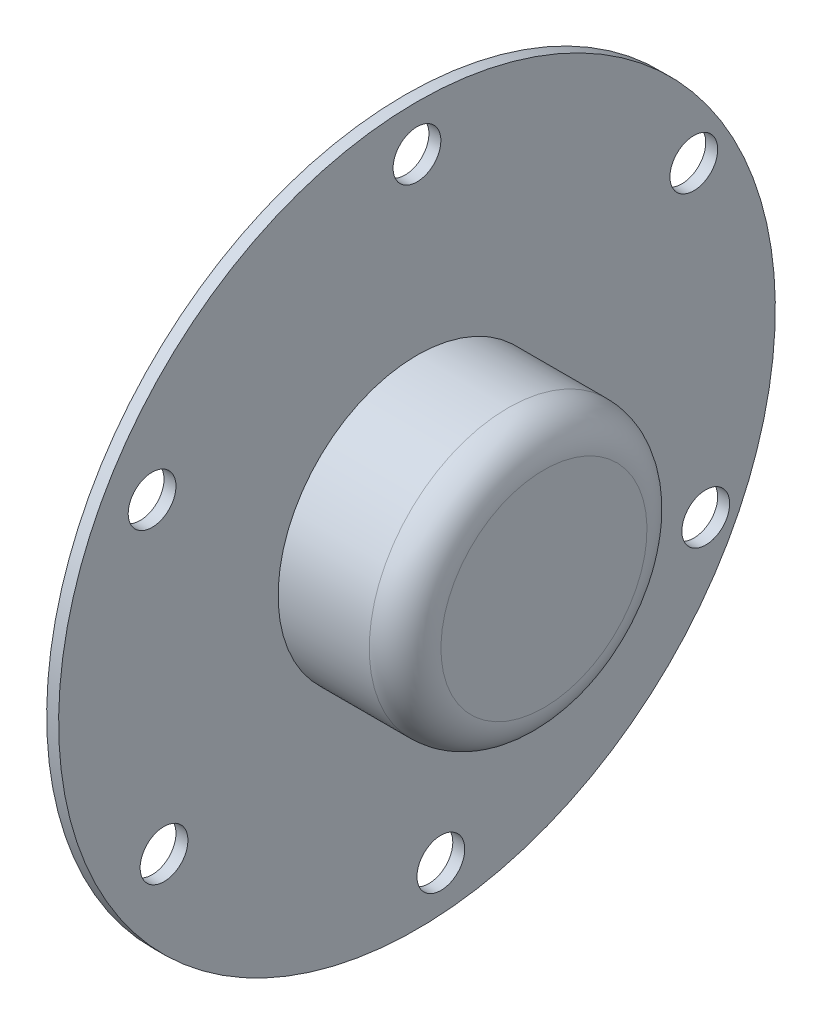
from build123d import *

# Parameters (mm, degrees)
FILLET1_R          = 3
SKETCH2_R          = 2
CUT_EXTRUDE1_DEPTH = 2


with BuildPart() as part:
    # Sketch1 → Revolve1 (revolve)
    with BuildSketch(Plane.XY):
        Polygon((0, 40.625), (0, 21.25), (10.625, 21.25), (10.625, 10.625), (11.63, 10.625), (11.63, 22.25), (1, 22.25), (1, 29.25), (1, 35.625), (1, 40.625), align=None)
    revolve(axis=Axis((11.63, 10.625, 0), (-1, 0, 0)))

    # Fillet1
    fillet1_edges = [part.edges().sort_by_distance(p)[0] for p in [
        (11.63, -1, 0),
    ]]
    fillet(fillet1_edges, radius=FILLET1_R)

    # Sketch2 → Cut-Extrude1 (cut)
    with BuildSketch(Plane(origin=(1, 0, 0), x_dir=(0, 0, -1), z_dir=(1, 0, 0))):
        with Locations(Location((0, 36.80872946, 0), (0, 0, 90))):
            Circle(SKETCH2_R)
        with Locations(Location((23.175774878, 24.582890134, 0), (0, 0, 90))):
            Circle(SKETCH2_R)
        with Locations(Location((24.175774878, -1.600839326, 0), (0, 0, 90))):
            Circle(SKETCH2_R)
        with Locations(Location((2, -15.55872946, 0), (0, 0, 90))):
            Circle(SKETCH2_R)
        with Locations(Location((-21.175774878, -3.332890134, 0), (0, 0, 90))):
            Circle(SKETCH2_R)
        with Locations(Location((-22.175774878, 22.850839326, 0), (0, 0, 90))):
            Circle(SKETCH2_R)
    extrude(amount=-CUT_EXTRUDE1_DEPTH, mode=Mode.SUBTRACT)


solid = part.part
